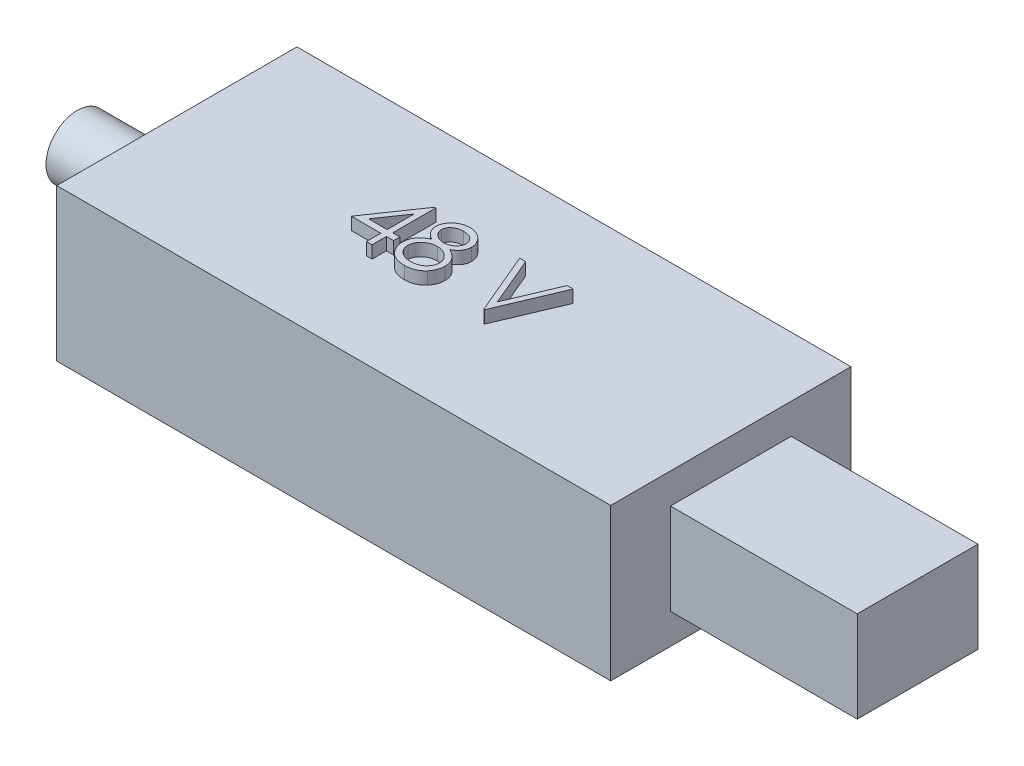
from build123d import *

# Parameters (mm, degrees)
SKETCH1_W           = 113
SKETCH1_H           = 49
BOSS_EXTRUDE1_DEPTH = 31
SKETCH2_W           = 24.62687601
SKETCH2_H           = 18.598470566
BOSS_EXTRUDE2_DEPTH = 38.1
SKETCH3_R           = 6.368506264
BOSS_EXTRUDE3_DEPTH = 20.32
BOSS_EXTRUDE4_DEPTH = 2.54


with BuildPart() as part:
    # Sketch1 → Boss-Extrude1 (new body)
    with BuildSketch(Plane(origin=(0, 0, 0), x_dir=(1, 0, 0), z_dir=(0, 1, 0))):
        Rectangle(SKETCH1_W, SKETCH1_H)
    extrude(amount=BOSS_EXTRUDE1_DEPTH)

    # Sketch2 → Boss-Extrude2 (add)
    with BuildSketch(Plane(origin=(56.5, 0, 0), x_dir=(0, 0, -1), z_dir=(1, 0, 0))):
        with Locations((0, 15.5)):
            Rectangle(SKETCH2_W, SKETCH2_H)
    extrude(amount=BOSS_EXTRUDE2_DEPTH)

    # Sketch3 → Boss-Extrude3 (add)
    with BuildSketch(Plane.ZY.offset(56.5)):
        with Locations((0, 15.5)):
            Circle(SKETCH3_R)
    extrude(amount=BOSS_EXTRUDE3_DEPTH)

    # Sketch5 → Boss-Extrude4 (add)
    # profile 1 of 3: a face of its own
    with BuildSketch(Plane(origin=(0, 31, 0), x_dir=(1, 0, 0), z_dir=(0, 1, 0))):
        Polygon((-11.579604813, 7.682518426), (-11.348094396, 7.682518426), (-11.348094396, -1.109789266), (-9.882709781, -1.109789266), (-9.882709781, -2.412353369), (-11.348094396, -2.412353369), (-11.348094396, -5.343122599), (-12.487837986, -5.343122599), (-12.487837986, -2.412353369), (-18.51219696, -2.412353369), align=None)
        Polygon((-12.487837986, -1.109789266), (-12.487837986, 4.405755606), (-16.273414909, -1.109789266), align=None, mode=Mode.SUBTRACT)
    # profile 2 of 3: a face of its own
    with BuildSketch(Plane(origin=(0, 31, 0), x_dir=(1, 0, 0), z_dir=(0, 1, 0))):
        with BuildLine():
            add(Edge.make_bspline(
                [(-2.568507057, 1.731937497), (-2.464553757, 1.677734057), (-2.261810106, 1.572019246), (-1.973058522, 1.401799957), (-1.70917066, 1.222399885), (-1.462824907, 1.042292623), (-1.23834932, 0.854580631), (-1.038253879, 0.658517464), (-0.857595944, 0.458997034), (-0.700018756, 0.252640757), (-0.561418806, 0.039996859), (-0.441631915, -0.179492789), (-0.339243779, -0.405347172), (-0.258098259, -0.640031669), (-0.191253472, -0.880098904), (-0.145259133, -1.128648724), (-0.12052346, -1.384043332), (-0.115846909, -1.556648313), (-0.113479012, -1.644044074)],
                knots=[0, 0, 0, 0, 1.272397273, 2.481599622, 3.635517121, 4.734568067, 5.792894095, 6.808321871, 7.773003508, 8.711915296, 9.623354172, 10.525449501, 11.423591555, 12.311487226, 13.218079475, 14.126165749, 15.051214107, 16, 16, 16, 16], degree=3))
            add(Edge.make_bspline(
                [(-0.113479012, -1.644044074), (-0.116278166, -1.766318704), (-0.121818743, -2.008346075), (-0.170078685, -2.365564823), (-0.24233435, -2.712499003), (-0.347851438, -3.049072555), (-0.48469717, -3.373428281), (-0.653341689, -3.685843831), (-0.844245205, -3.99143961), (-0.997560473, -4.17947001), (-1.075137666, -4.274612984)],
                knots=[0, 0, 0, 0, 1.025265484, 2.029385089, 3.018602448, 3.995076438, 4.983346944, 5.966715145, 6.97116228, 8, 8, 8, 8], degree=3))
            add(Edge.make_bspline(
                [(-1.075137666, -4.274612984), (-1.176144301, -4.385624679), (-1.376909405, -4.606276266), (-1.720836028, -4.89275492), (-2.098286863, -5.133508436), (-2.507801384, -5.329712167), (-2.948284924, -5.482423712), (-3.419643626, -5.592160849), (-3.92279641, -5.655016521), (-4.268619119, -5.664102426), (-4.446031095, -5.668763625)],
                knots=[0, 0, 0, 0, 0.954267603, 1.896743057, 2.838368354, 3.796610408, 4.779680527, 5.799409237, 6.871065594, 8, 8, 8, 8], degree=3))
            add(Edge.make_bspline(
                [(-4.446031095, -5.668763625), (-4.616622534, -5.664581776), (-4.948576146, -5.656444324), (-5.431749016, -5.601310244), (-5.882138441, -5.504689127), (-6.302363183, -5.372447259), (-6.68988987, -5.200415859), (-7.043614266, -4.986299633), (-7.368639822, -4.738716972), (-7.655102741, -4.450557317), (-7.909423666, -4.141918751), (-8.132827744, -3.823505767), (-8.318516543, -3.495289298), (-8.475732003, -3.162163338), (-8.596084543, -2.819458721), (-8.679440849, -2.468938673), (-8.732379217, -2.111215441), (-8.739422764, -1.869800585), (-8.742966191, -1.748350965)],
                knots=[0, 0, 0, 0, 1.256902934, 2.445805442, 3.576955095, 4.645999104, 5.686449165, 6.692658513, 7.68621702, 8.689161843, 9.678783111, 10.630372946, 11.551080876, 12.453998257, 13.34127905, 14.221779781, 15.105423033, 16, 16, 16, 16], degree=3))
            add(Edge.make_bspline(
                [(-8.742966191, -1.748350965), (-8.740869309, -1.659236182), (-8.736725128, -1.483113918), (-8.708041822, -1.222911498), (-8.661928262, -0.969651238), (-8.599301091, -0.722397682), (-8.51442508, -0.482950893), (-8.411946483, -0.250176317), (-8.292450541, -0.023811158), (-8.154270314, 0.197382496), (-7.993517255, 0.410305297), (-7.811494869, 0.618570764), (-7.604565174, 0.818947253), (-7.37503024, 1.013882909), (-7.125513197, 1.206835728), (-6.849533015, 1.387377944), (-6.554405815, 1.56829113), (-6.344654771, 1.676452768), (-6.237056736, 1.731937497)],
                knots=[0, 0, 0, 0, 0.941657376, 1.861047343, 2.762797495, 3.66048619, 4.553285746, 5.444104102, 6.34607688, 7.256116206, 8.197091036, 9.162375105, 10.176350973, 11.237807142, 12.343728897, 13.50695164, 14.721116704, 16, 16, 16, 16], degree=3))
            add(Edge.make_bspline(
                [(-6.237056736, 1.731937497), (-6.384345438, 1.812255086), (-6.669537592, 1.967772419), (-7.047160993, 2.25351083), (-7.371521255, 2.562983758), (-7.633702659, 2.902726156), (-7.840067601, 3.262124814), (-7.981649395, 3.638931101), (-8.077430922, 4.026158142), (-8.086919009, 4.290703484), (-8.09168414, 4.423564099)],
                knots=[0, 0, 0, 0, 1.166880483, 2.259407225, 3.286803203, 4.280235371, 5.237608625, 6.161067461, 7.076446754, 8, 8, 8, 8], degree=3))
            add(Edge.make_bspline(
                [(-8.09168414, 4.423564099), (-8.085749887, 4.558900954), (-8.073821003, 4.830951634), (-7.977361525, 5.235922425), (-7.82017157, 5.633673961), (-7.606372523, 6.022278404), (-7.340081768, 6.388583469), (-7.020598587, 6.71711776), (-6.655552339, 7.004905139), (-6.246765221, 7.246481537), (-5.80685088, 7.443090813), (-5.342699539, 7.57872109), (-4.862398264, 7.667389285), (-4.535472254, 7.677428289), (-4.36970898, 7.682518426)],
                knots=[0, 0, 0, 0, 0.888701115, 1.786444228, 2.72001202, 3.692817113, 4.693886446, 5.687152267, 6.695133018, 7.739871481, 8.800368666, 9.853104506, 10.91144658, 12, 12, 12, 12], degree=3))
            add(Edge.make_bspline(
                [(-4.36970898, 7.682518426), (-4.208223708, 7.677270267), (-3.88979315, 7.666921495), (-3.421726929, 7.580609109), (-2.973870946, 7.436447708), (-2.547769621, 7.240877784), (-2.15105113, 6.999988027), (-1.800522751, 6.708247713), (-1.490887382, 6.381162657), (-1.234766866, 6.014968668), (-1.023718667, 5.627857451), (-0.876758255, 5.222827161), (-0.782589663, 4.808629147), (-0.770712028, 4.528365533), (-0.764761063, 4.387947112)],
                knots=[0, 0, 0, 0, 1.072916533, 2.115669174, 3.151510826, 4.193348718, 5.225979165, 6.227137561, 7.216255879, 8.211077061, 9.189680878, 10.138522389, 11.067357538, 12, 12, 12, 12], degree=3))
            add(Edge.make_bspline(
                [(-0.764761063, 4.387947112), (-0.769966469, 4.250146075), (-0.78018959, 3.979512669), (-0.866186513, 3.584990724), (-1.011014822, 3.215522182), (-1.208750785, 2.866914613), (-1.46647184, 2.545490322), (-1.780737814, 2.247161988), (-2.149043178, 1.969478925), (-2.425761251, 1.812774118), (-2.568507057, 1.731937497)],
                knots=[0, 0, 0, 0, 0.975232327, 1.915300861, 2.843280834, 3.77672583, 4.742871857, 5.749627742, 6.839139064, 8, 8, 8, 8], degree=3))
        make_face()
        with BuildLine():
            add(Edge.make_bspline(
                [(-4.433310742, 6.379954324), (-4.522395095, 6.377590525), (-4.696683041, 6.372965902), (-4.952238505, 6.348804562), (-5.195252524, 6.301802889), (-5.428264143, 6.239250993), (-5.64807869, 6.154748865), (-5.857681503, 6.055344117), (-6.053505306, 5.934490679), (-6.237914034, 5.798922904), (-6.403923987, 5.649814359), (-6.551260503, 5.494461722), (-6.673645374, 5.329813871), (-6.777571686, 5.159966394), (-6.852978906, 4.979878303), (-6.909455095, 4.795070892), (-6.947632715, 4.603208784), (-6.950493445, 4.472084874), (-6.95194055, 4.405755606)],
                knots=[0, 0, 0, 0, 1.203892937, 2.355340988, 3.463153438, 4.544400666, 5.610487187, 6.640501085, 7.674077295, 8.714426146, 9.728707835, 10.68524104, 11.601827946, 12.495867327, 13.368432065, 14.231010473, 15.105153427, 16, 16, 16, 16], degree=3))
            add(Edge.make_bspline(
                [(-6.95194055, 4.405755606), (-6.94944639, 4.339423471), (-6.944517572, 4.208341644), (-6.906398964, 4.014772359), (-6.849586948, 3.824556706), (-6.760140263, 3.642217686), (-6.65285662, 3.461430068), (-6.520444692, 3.286712227), (-6.362641648, 3.117456117), (-6.184742079, 2.955101344), (-5.990934499, 2.803068689), (-5.785615256, 2.671086002), (-5.571361208, 2.560653659), (-5.350373699, 2.468744104), (-5.120400476, 2.39729776), (-4.882850701, 2.346611529), (-4.63768445, 2.315108283), (-4.471566342, 2.311345377), (-4.387517473, 2.309441503)],
                knots=[0, 0, 0, 0, 0.873023192, 1.725219244, 2.590779336, 3.480155217, 4.391973325, 5.357036234, 6.360879153, 7.436073238, 8.526419356, 9.601555421, 10.645666583, 11.697338044, 12.750135903, 13.812665442, 14.89329948, 16, 16, 16, 16], degree=3))
            add(Edge.make_bspline(
                [(-4.387517473, 2.309441503), (-4.279567097, 2.312608764), (-4.064732563, 2.318912003), (-3.748033274, 2.37751769), (-3.440103107, 2.469704877), (-3.144233368, 2.595833898), (-2.868082444, 2.754140704), (-2.621919911, 2.943671941), (-2.407845471, 3.160051265), (-2.228083829, 3.399910126), (-2.088710957, 3.655185889), (-1.980210112, 3.911364095), (-1.916850845, 4.171177904), (-1.90858653, 4.345229459), (-1.904504653, 4.431196311)],
                knots=[0, 0, 0, 0, 1.076279235, 2.141928126, 3.20205304, 4.278698113, 5.344010996, 6.36967002, 7.368914609, 8.37248503, 9.349703398, 10.264243087, 11.142681841, 12, 12, 12, 12], degree=3))
            add(Edge.make_bspline(
                [(-1.904504653, 4.431196311), (-1.906434681, 4.491532327), (-1.910265511, 4.611290671), (-1.941834285, 4.788141311), (-1.993998022, 4.960968657), (-2.064621198, 5.131200439), (-2.157548168, 5.296448238), (-2.267726791, 5.459309729), (-2.401564839, 5.616121215), (-2.551774754, 5.770537062), (-2.722119523, 5.913444805), (-2.912270862, 6.039119325), (-3.121253899, 6.145844162), (-3.349073575, 6.232526215), (-3.594890871, 6.297631312), (-3.857573586, 6.34638606), (-4.139312008, 6.373865636), (-4.333185676, 6.377880742), (-4.433310742, 6.379954324)],
                knots=[0, 0, 0, 0, 0.814439003, 1.616544685, 2.417341072, 3.248991801, 4.09997495, 4.973547432, 5.9003056, 6.880240646, 7.880314356, 8.896779544, 9.951930927, 11.043077905, 12.18215768, 13.381699519, 14.647792085, 16, 16, 16, 16], degree=3))
        make_face(mode=Mode.SUBTRACT)
        with BuildLine():
            add(Edge.make_bspline(
                [(-4.359532698, 1.006877401), (-4.472474834, 1.004868473), (-4.694039747, 1.000927448), (-5.0186406, 0.957059832), (-5.330164944, 0.895993178), (-5.627562427, 0.803352707), (-5.910707464, 0.68289687), (-6.181132855, 0.53799154), (-6.436769811, 0.366703217), (-6.674088275, 0.17120807), (-6.890798642, -0.039464806), (-7.080929616, -0.262484554), (-7.242392048, -0.493706316), (-7.372415558, -0.73606669), (-7.479138129, -0.984433735), (-7.549219912, -1.244992724), (-7.594147837, -1.512734535), (-7.600180814, -1.694744035), (-7.603222601, -1.786512022)],
                knots=[0, 0, 0, 0, 1.140299081, 2.23698856, 3.303958914, 4.344563908, 5.37730929, 6.408454204, 7.439741482, 8.480804886, 9.510774543, 10.48932336, 11.43758569, 12.353841022, 13.263987381, 14.161954604, 15.073269652, 16, 16, 16, 16], degree=3))
            add(Edge.make_bspline(
                [(-7.603222601, -1.786512022), (-7.59827592, -1.90056131), (-7.588461818, -2.126832433), (-7.510604872, -2.46125272), (-7.385653072, -2.78499769), (-7.211390145, -3.095429062), (-6.99560781, -3.385533733), (-6.730263198, -3.638404433), (-6.431846444, -3.863090941), (-6.090260516, -4.044811734), (-5.717140083, -4.189935922), (-5.31258438, -4.289924701), (-4.88239939, -4.356115105), (-4.585366012, -4.362785077), (-4.433310742, -4.366199522)],
                knots=[0, 0, 0, 0, 0.898778495, 1.783155532, 2.693654817, 3.627872908, 4.583023416, 5.533784346, 6.509005473, 7.520592997, 8.575161974, 9.658835044, 10.801527049, 12, 12, 12, 12], degree=3))
            add(Edge.make_bspline(
                [(-4.433310742, -4.366199522), (-4.314473693, -4.363917846), (-4.082941013, -4.359472409), (-3.745171998, -4.32023197), (-3.426421779, -4.258003332), (-3.127308482, -4.167493894), (-2.844483692, -4.057003979), (-2.582742664, -3.914865283), (-2.335352009, -3.753203997), (-2.114502192, -3.5614044), (-1.913358835, -3.356464519), (-1.73797803, -3.139512077), (-1.585732059, -2.916443354), (-1.466239734, -2.68221731), (-1.370713042, -2.441327648), (-1.302047572, -2.191553079), (-1.259679591, -1.932127519), (-1.255394626, -1.756145176), (-1.253222601, -1.666940708)],
                knots=[0, 0, 0, 0, 1.224942928, 2.386581632, 3.501229538, 4.569074225, 5.605009692, 6.626002462, 7.634866581, 8.645888296, 9.63523824, 10.59253846, 11.518950513, 12.414518923, 13.29783783, 14.186679152, 15.080837789, 16, 16, 16, 16], degree=3))
            add(Edge.make_bspline(
                [(-1.253222601, -1.666940708), (-1.256509538, -1.580300072), (-1.262990801, -1.409459873), (-1.304126796, -1.156307048), (-1.376392979, -0.911731122), (-1.47555239, -0.672789672), (-1.607563312, -0.444324108), (-1.763028983, -0.220382572), (-1.950604785, -0.007180616), (-2.162559062, 0.196937761), (-2.393550148, 0.385680577), (-2.639085217, 0.552647254), (-2.897274265, 0.693262076), (-3.167570944, 0.807621931), (-3.449375076, 0.897565035), (-3.742479387, 0.96039736), (-4.047227044, 0.999947348), (-4.254254718, 1.004541286), (-4.359532698, 1.006877401)],
                knots=[0, 0, 0, 0, 0.917430815, 1.809013306, 2.70690318, 3.612392954, 4.541220862, 5.495268465, 6.494511384, 7.542276156, 8.608045339, 9.649016899, 10.681629292, 11.715607085, 12.752076957, 13.808767841, 14.885711793, 16, 16, 16, 16], degree=3))
        make_face(mode=Mode.SUBTRACT)
    # profile 3 of 3: a face of its own
    with BuildSketch(Plane(origin=(0, 31, 0), x_dir=(1, 0, 0), z_dir=(0, 1, 0))):
        Polygon((6.073700475, 7.356877401), (7.294854322, 7.356877401), (11.528187655, -2.651495997), (15.761520988, 7.356877401), (16.982674834, 7.356877401), (11.609597911, -5.343122599), (11.446777399, -5.343122599), align=None)
    extrude(amount=BOSS_EXTRUDE4_DEPTH)


solid = part.part
